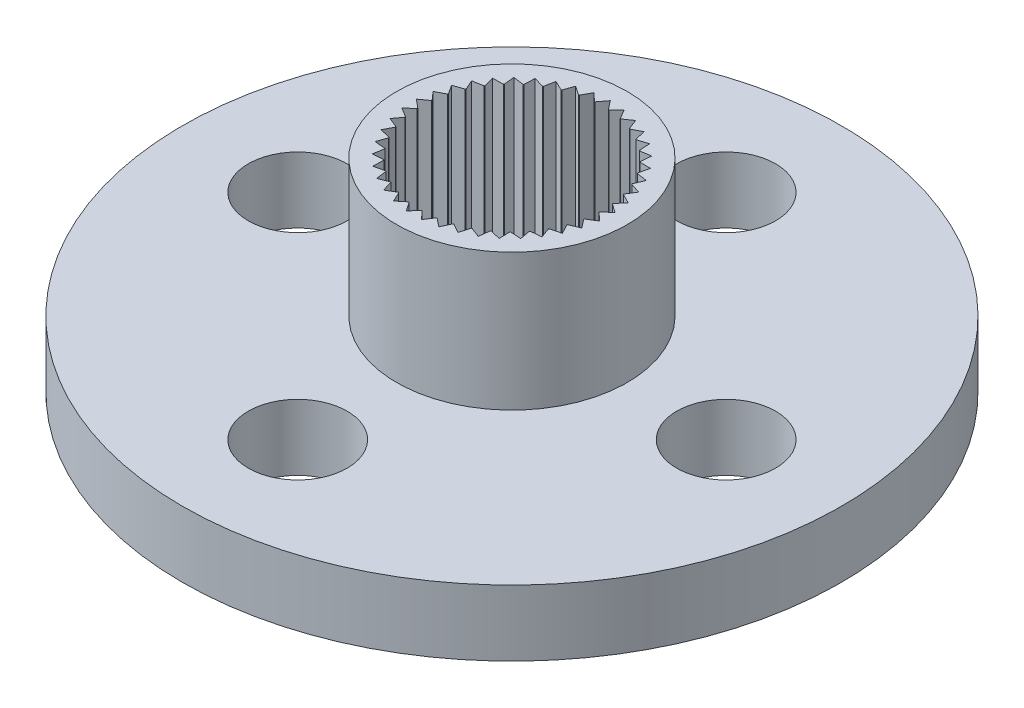
from build123d import *

# Parameters (mm, degrees)
SKETCH1_R           = 10
SKETCH1_R_2         = 1.5
BOSS_EXTRUDE1_DEPTH = 2
SKETCH2_R           = 3.5
SKETCH2_R_2         = 3
BOSS_EXTRUDE2_DEPTH = 4.15
BOSS_EXTRUDE3_START = -4.15
BOSS_EXTRUDE3_DEPTH = 4.15


with BuildPart() as part:
    # Sketch1 → Boss-Extrude1 (new body)
    with BuildSketch(Plane(origin=(0, 0, 0), x_dir=(1, 0, 0), z_dir=(0, 1, 0))):
        with Locations(Location((0, 0, 0), (0, 0, 270))):
            Circle(SKETCH1_R)
        with Locations(Location((0, 0, 0), (0, 0, 270))):
            Circle(SKETCH1_R_2, mode=Mode.SUBTRACT)
        with Locations(Location((-6.5, 0, 0), (0, 0, 270))):
            Circle(SKETCH1_R_2, mode=Mode.SUBTRACT)
        with Locations(Location((0, -6.5, 0), (0, 0, 270))):
            Circle(SKETCH1_R_2, mode=Mode.SUBTRACT)
        with Locations(Location((6.5, 0, 0), (0, 0, 90))):
            Circle(SKETCH1_R_2, mode=Mode.SUBTRACT)
        with Locations(Location((0, 6.5, 0), (0, 0, 90))):
            Circle(SKETCH1_R_2, mode=Mode.SUBTRACT)
    extrude(amount=BOSS_EXTRUDE1_DEPTH)

    # Sketch2 → Boss-Extrude2 (add)
    with BuildSketch(Plane(origin=(0, 2, 0), x_dir=(1, 0, 0), z_dir=(0, 1, 0))):
        with Locations(Location((0, 0, 0), (0, 0, 90))):
            Circle(SKETCH2_R)
        with Locations(Location((0, 0, 0), (0, 0, 90))):
            Circle(SKETCH2_R_2, mode=Mode.SUBTRACT)
    extrude(amount=BOSS_EXTRUDE2_DEPTH)

    # Sketch5 → Boss-Extrude3 (add)
    with BuildSketch(Plane(origin=(0, 6.15, 0), x_dir=(1, 0, 0), z_dir=(0, 1, 0)).offset(BOSS_EXTRUDE3_START)):
        with BuildLine():
            ThreePointArc((-2.828791658, 0.998968346), (-2.896961701, 0.779495286), (-2.948131221, 0.555447838))
            Line((-2.948131221, 0.555447838), (-2.658267303, 0.704354274))
            Line((-2.658267303, 0.704354274), (-2.652790141, 0.724709921))
            Line((-2.652790141, 0.724709921), (-2.828791658, 0.998968346))
        make_face()
        with BuildLine():
            ThreePointArc((-2.643147616, 1.419073882), (-2.74402114, 1.212579062), (-2.828791658, 0.998968346))
            Line((-2.828791658, 0.998968346), (-2.519594361, 1.101882142))
            Line((-2.519594361, 1.101882142), (-2.511074114, 1.121163144))
            Line((-2.511074114, 1.121163144), (-2.643147616, 1.419073882))
        make_face()
        with BuildLine():
            Line((-2.732327015, 0.311270112), (-2.948131221, 0.555447838))
            ThreePointArc((-2.948131221, 0.555447838), (-2.981999935, 0.328140802), (-2.998369088, 0.098908104))
            Line((-2.998369088, 0.098908104), (-2.734632713, 0.29031694))
            Line((-2.734632713, 0.29031694), (-2.732327015, 0.311270112))
        make_face()
        with BuildLine():
            Line((-2.74782046, -0.109465605), (-2.998369088, 0.098908104))
            ThreePointArc((-2.998369088, 0.098908104), (-2.997142618, -0.130905025), (-2.978327724, -0.359949952))
            Line((-2.978327724, -0.359949952), (-2.746900649, -0.130525178))
            Line((-2.746900649, -0.130525178), (-2.74782046, -0.109465605))
        make_face()
        with BuildLine():
            Line((-2.698907323, -0.527635541), (-2.978327724, -0.359949952))
            ThreePointArc((-2.978327724, -0.359949952), (-2.942034819, -0.586882549), (-2.888476883, -0.810371086))
            Line((-2.888476883, -0.810371086), (-2.694783563, -0.548307896))
            Line((-2.694783563, -0.548307896), (-2.698907323, -0.527635541))
        make_face()
        with BuildLine():
            Line((-2.586734085, -0.933438147), (-2.888476883, -0.810371086))
            ThreePointArc((-2.888476883, -0.810371086), (-2.817968216, -1.029104043), (-2.730922592, -1.241797809))
            Line((-2.730922592, -1.241797809), (-2.579503034, -0.953238742))
            Line((-2.579503034, -0.953238742), (-2.586734085, -0.933438147))
        make_face()
        with BuildLine():
            Line((-2.184545427, -1.670407518), (-2.509357789, -1.644117844))
            ThreePointArc((-2.509357789, -1.644117844), (-2.376138842, -1.831383139), (-2.228975768, -2.00790115))
            Line((-2.228975768, -2.00790115), (-2.171677122, -1.687103577))
            Line((-2.171677122, -1.687103577), (-2.184545427, -1.670407518))
        make_face()
        with BuildLine():
            Line((-2.413929992, -1.317361754), (-2.730922592, -1.241797809))
            ThreePointArc((-2.730922592, -1.241797809), (-2.627850827, -1.447204211), (-2.509357789, -1.644117844))
            Line((-2.509357789, -1.644117844), (-2.40376114, -1.33582648))
            Line((-2.40376114, -1.33582648), (-2.413929992, -1.317361754))
        make_face()
        with BuildLine():
            Line((-1.903956968, -1.984300346), (-2.228975768, -2.00790115))
            ThreePointArc((-2.228975768, -2.00790115), (-2.068732177, -2.172635998), (-1.896348443, -2.324620955))
            Line((-1.896348443, -2.324620955), (-1.888690833, -1.998836396))
            Line((-1.888690833, -1.998836396), (-1.903956968, -1.984300346))
        make_face()
        with BuildLine():
            Line((-1.578741372, -2.251682855), (-1.896348443, -2.324620955))
            ThreePointArc((-1.896348443, -2.324620955), (-1.712836182, -2.462964111), (-1.519272318, -2.586853615))
            Line((-1.519272318, -2.586853615), (-1.561435232, -2.263718184))
            Line((-1.561435232, -2.263718184), (-1.578741372, -2.251682855))
        make_face()
        with BuildLine():
            Line((-1.216521416, -2.466287827), (-1.519272318, -2.586853615))
            ThreePointArc((-1.519272318, -2.586853615), (-1.316792759, -2.695562433), (-1.106585738, -2.788452618))
            Line((-1.106585738, -2.788452618), (-1.197580912, -2.475540337))
            Line((-1.197580912, -2.475540337), (-1.216521416, -2.466287827))
        make_face()
        with BuildLine():
            Line((-0.825787229, -2.623085102), (-1.106585738, -2.788452618))
            ThreePointArc((-1.106585738, -2.788452618), (-0.88988483, -2.864979056), (-0.667961725, -2.924692656))
            Line((-0.667961725, -2.924692656), (-0.805656311, -2.629337922))
            Line((-0.805656311, -2.629337922), (-0.825787229, -2.623085102))
        make_face()
        with BuildLine():
            Line((-0.41569729, -2.718399486), (-0.667961725, -2.924692656))
            ThreePointArc((-0.667961725, -2.924692656), (-0.442118755, -2.967242998), (-0.213681256, -2.992380377))
            Line((-0.213681256, -2.992380377), (-0.394847808, -2.721506055))
            Line((-0.394847808, -2.721506055), (-0.41569729, -2.718399486))
        make_face()
        with BuildLine():
            Line((0.004136242, -2.749996889), (-0.213681256, -2.992380377))
            ThreePointArc((-0.213681256, -2.992380377), (0.016010209, -2.999957279), (0.24560772, -2.989929238))
            Line((0.24560772, -2.989929238), (0.025215592, -2.749884393))
            Line((0.025215592, -2.749884393), (0.004136242, -2.749996889))
        make_face()
        with BuildLine():
            Line((0.423872824, -2.717136697), (0.24560772, -2.989929238))
            ThreePointArc((0.24560772, -2.989929238), (0.473763907, -2.962355104), (0.69913986, -2.917396692))
            Line((0.69913986, -2.917396692), (0.44468796, -2.713807771))
            Line((0.44468796, -2.713807771), (0.423872824, -2.717136697))
        make_face()
        with BuildLine():
            Line((0.833674186, -2.620589123), (0.69913986, -2.917396692))
            ThreePointArc((0.69913986, -2.917396692), (0.920412981, -2.855317836), (1.136284754, -2.77648284))
            Line((1.136284754, -2.77648284), (0.85373722, -2.614121795))
            Line((0.85373722, -2.614121795), (0.833674186, -2.620589123))
        make_face()
        with BuildLine():
            Line((1.223934931, -2.462617161), (1.136284754, -2.77648284))
            ThreePointArc((1.136284754, -2.77648284), (1.345488355, -2.681354338), (1.546796096, -2.570490583))
            Line((1.546796096, -2.570490583), (1.242775602, -2.45316302))
            Line((1.242775602, -2.45316302), (1.223934931, -2.462617161))
        make_face()
        with BuildLine():
            Line((1.58550768, -2.246923541), (1.546796096, -2.570490583))
            ThreePointArc((1.546796096, -2.570490583), (1.739026622, -2.444542167), (1.921051849, -2.304248206))
            Line((1.921051849, -2.304248206), (1.602684378, -2.234704183))
            Line((1.602684378, -2.234704183), (1.58550768, -2.246923541))
        make_face()
        with BuildLine():
            Line((1.909917472, -1.978563936), (1.921051849, -2.304248206))
            ThreePointArc((1.921051849, -2.304248206), (2.091803579, -2.150432), (2.250279774, -1.983996204))
            Line((2.250279774, -1.983996204), (1.92502759, -1.963865774))
            Line((1.92502759, -1.963865774), (1.909917472, -1.978563936))
        make_face()
        with BuildLine():
            Line((2.189560417, -1.663828471), (2.250279774, -1.983996204))
            ThreePointArc((2.250279774, -1.983996204), (2.395550433, -1.805917529), (2.52676305, -1.617241012))
            Line((2.52676305, -1.617241012), (2.202249787, -1.646996016))
            Line((2.202249787, -1.646996016), (2.189560417, -1.663828471))
        make_face()
        with BuildLine():
            Line((2.417881922, -1.310094276), (2.52676305, -1.617241012))
            ThreePointArc((2.52676305, -1.617241012), (2.643147616, -1.419073882), (2.74402114, -1.212579062))
            Line((2.74402114, -1.212579062), (2.427853116, -1.291522067))
            Line((2.427853116, -1.291522067), (2.417881922, -1.310094276))
        make_face()
        with BuildLine():
            Line((2.589530324, -0.925652581), (2.74402114, -1.212579062))
            ThreePointArc((2.74402114, -1.212579062), (2.828791658, -0.998968346), (2.896961701, -0.779495286))
            Line((2.896961701, -0.779495286), (2.596549625, -0.905775935))
            Line((2.596549625, -0.905775935), (2.589530324, -0.925652581))
        make_face()
        with BuildLine():
            Line((2.70048233, -0.519514375), (2.896961701, -0.779495286))
            ThreePointArc((2.896961701, -0.779495286), (2.948131221, -0.555447838), (2.981999935, -0.328140802))
            Line((2.981999935, -0.328140802), (2.704385212, -0.498799183))
            Line((2.704385212, -0.498799183), (2.70048233, -0.519514375))
        make_face()
        with BuildLine():
            ThreePointArc((3, 0), (2.99928557, 0.065468103), (2.997142618, 0.130905025))
            Line((2.997142618, 0.130905025), (2.748832302, -0.080131001))
            Line((2.748832302, -0.080131001), (2.748137319, -0.101199192))
            Line((2.748137319, -0.101199192), (2.981999935, -0.328140802))
            ThreePointArc((2.981999935, -0.328140802), (2.995496604, -0.164317063), (3, 0))
        make_face()
        with BuildLine():
            ThreePointArc((2.997142618, 0.130905025), (2.978327724, 0.359949952), (2.942034819, 0.586882549))
            Line((2.942034819, 0.586882549), (2.728849092, 0.340415383))
            Line((2.728849092, 0.340415383), (2.731378298, 0.319488015))
            Line((2.731378298, 0.319488015), (2.997142618, 0.130905025))
        make_face()
        with BuildLine():
            ThreePointArc((2.942034819, 0.586882549), (2.888476883, 0.810371086), (2.817968216, 1.029104043))
            Line((2.817968216, 1.029104043), (2.644903972, 0.75298272))
            Line((2.644903972, 0.75298272), (2.650598085, 0.732686693))
            Line((2.650598085, 0.732686693), (2.942034819, 0.586882549))
        make_face()
        with BuildLine():
            ThreePointArc((2.817968216, 1.029104043), (2.730922592, 1.241797809), (2.627850827, 1.447204211))
            Line((2.627850827, 1.447204211), (2.498964545, 1.14790078))
            Line((2.498964545, 1.14790078), (2.5076901, 1.128711816))
            Line((2.5076901, 1.128711816), (2.817968216, 1.029104043))
        make_face()
        with BuildLine():
            ThreePointArc((2.627850827, 1.447204211), (2.509357789, 1.644117844), (2.376138842, 1.831383139))
            Line((2.376138842, 1.831383139), (2.294451508, 1.515913018))
            Line((2.294451508, 1.515913018), (2.306003984, 1.49828089))
            Line((2.306003984, 1.49828089), (2.627850827, 1.447204211))
        make_face()
        with BuildLine():
            ThreePointArc((2.376138842, 1.831383139), (2.228975768, 2.00790115), (2.068732177, 2.172635998))
            Line((2.068732177, 2.172635998), (2.036158471, 1.848393541))
            Line((2.036158471, 1.848393541), (2.050267089, 1.832731531))
            Line((2.050267089, 1.832731531), (2.376138842, 1.831383139))
        make_face()
        with BuildLine():
            ThreePointArc((2.068732177, 2.172635998), (1.896348443, 2.324620955), (1.712836182, 2.462964111))
            Line((1.712836182, 2.462964111), (1.730139606, 2.137549285))
            Line((1.730139606, 2.137549285), (1.746473671, 2.124224497))
            Line((1.746473671, 2.124224497), (2.068732177, 2.172635998))
        make_face()
        with BuildLine():
            ThreePointArc((1.712836182, 2.462964111), (1.519272318, 2.586853615), (1.316792759, 2.695562433))
            Line((1.316792759, 2.695562433), (1.383567734, 2.376602685))
            Line((1.383567734, 2.376602685), (1.401744391, 2.365927442))
            Line((1.401744391, 2.365927442), (1.712836182, 2.462964111))
        make_face()
        with BuildLine():
            ThreePointArc((1.316792759, 2.695562433), (1.106585738, 2.788452618), (0.88988483, 2.864979056))
            Line((0.88988483, 2.864979056), (1.004566208, 2.559950533))
            Line((1.004566208, 2.559950533), (1.02415941, 2.552175053))
            Line((1.02415941, 2.552175053), (1.316792759, 2.695562433))
        make_face()
        with BuildLine():
            ThreePointArc((0.88988483, 2.864979056), (0.667961725, 2.924692656), (0.442118755, 2.967242998))
            Line((0.442118755, 2.967242998), (0.602018501, 2.683295311))
            Line((0.602018501, 2.683295311), (0.622569001, 2.678601844))
            Line((0.622569001, 2.678601844), (0.88988483, 2.864979056))
        make_face()
        with BuildLine():
            ThreePointArc((0.442118755, 2.967242998), (0.213681256, 2.992380377), (-0.016010209, 2.999957279))
            Line((-0.016010209, 2.999957279), (0.185359991, 2.74374592))
            Line((0.185359991, 2.74374592), (0.206386102, 2.742244478))
            Line((0.206386102, 2.742244478), (0.442118755, 2.967242998))
        make_face()
        with BuildLine():
            ThreePointArc((-0.016010209, 2.999957279), (-0.24560772, 2.989929238), (-0.473763907, 2.962355104))
            Line((-0.473763907, 2.962355104), (-0.2356432, 2.739885451))
            Line((-0.2356432, 2.739885451), (-0.214634313, 2.741611226))
            Line((-0.214634313, 2.741611226), (-0.016010209, 2.999957279))
        make_face()
        with BuildLine():
            ThreePointArc((-0.473763907, 2.962355104), (-0.69913986, 2.917396692), (-0.920412981, 2.855317836))
            Line((-0.920412981, 2.855317836), (-0.651123115, 2.671804388))
            Line((-0.651123115, 2.671804388), (-0.630623881, 2.67671693))
            Line((-0.630623881, 2.67671693), (-0.473763907, 2.962355104))
        make_face()
        with BuildLine():
            ThreePointArc((-0.920412981, 2.855317836), (-1.136284754, 2.77648284), (-1.345488355, 2.681354338))
            Line((-1.345488355, 2.681354338), (-1.051341255, 2.541098496))
            Line((-1.051341255, 2.541098496), (-1.031832159, 2.549082658))
            Line((-1.031832159, 2.549082658), (-0.920412981, 2.855317836))
        make_face()
        with BuildLine():
            ThreePointArc((-1.345488355, 2.681354338), (-1.546796096, 2.570490583), (-1.739026622, 2.444542167))
            Line((-1.739026622, 2.444542167), (-1.426916848, 2.350831408))
            Line((-1.426916848, 2.350831408), (-1.408855167, 2.361700048))
            Line((-1.408855167, 2.361700048), (-1.345488355, 2.681354338))
        make_face()
        with BuildLine():
            ThreePointArc((-1.739026622, 2.444542167), (-1.921051849, 2.304248206), (-2.091803579, 2.150432))
            Line((-2.091803579, 2.150432), (-1.769046719, 2.105462825))
            Line((-1.769046719, 2.105462825), (-1.752855803, 2.118961192))
            Line((-1.752855803, 2.118961192), (-1.739026622, 2.444542167))
        make_face()
        with BuildLine():
            ThreePointArc((-2.091803579, 2.150432), (-2.250279774, 1.983996204), (-2.395550433, 1.805917529))
            Line((-2.395550433, 1.805917529), (-2.069711634, 1.810743978))
            Line((-2.069711634, 1.810743978), (-2.055770985, 1.826555681))
            Line((-2.055770985, 1.826555681), (-2.091803579, 2.150432))
        make_face()
        with BuildLine():
            ThreePointArc((-2.395550433, 1.805917529), (-2.52676305, 1.617241012), (-2.643147616, 1.419073882))
            Line((-2.643147616, 1.419073882), (-2.321864263, 1.473582826))
            Line((-2.321864263, 1.473582826), (-2.310500638, 1.491337253))
            Line((-2.310500638, 1.491337253), (-2.395550433, 1.805917529))
        make_face()
    extrude(amount=BOSS_EXTRUDE3_DEPTH)


solid = part.part
